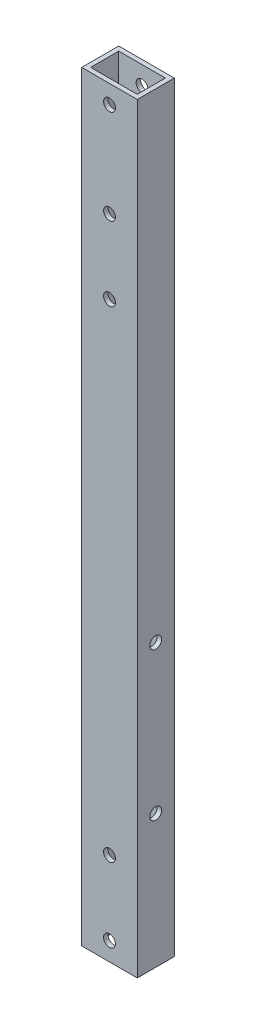
from build123d import *

# Parameters (mm, degrees)
SKETCH_1_W          = 15
SKETCH_1_H          = 10
SKETCH_1_W_2        = 12.6
SKETCH_1_H_2        = 7.6
EXTRUDE_1_DEPTH     = 110
SKETCH_2_R          = 1.6
CUT_EXTRUDE_1_DEPTH = 100
SKETCH_3_R          = 1.6
CUT_EXTRUDE_2_DEPTH = 15
SKETCH_4_R          = 1.6
CUT_EXTRUDE_3_DEPTH = 10
SKETCH_5_W          = 15
SKETCH_5_H          = 10
CUT_EXTRUDE_4_DEPTH = 14.5
SKETCH_6_R          = 1.6
CUT_EXTRUDE_5_DEPTH = 15


with BuildPart() as part:
    # ｽｹｯﾁ1 → ﾎﾞｽ - 押し出し1 (new, symmetric)
    with BuildSketch(Plane(origin=(0, 0, 0), x_dir=(1, 0, 0), z_dir=(0, 1, 0))):
        Rectangle(SKETCH_1_W, SKETCH_1_H)
        Rectangle(SKETCH_1_W_2, SKETCH_1_H_2, mode=Mode.SUBTRACT)
    extrude(amount=EXTRUDE_1_DEPTH, both=True)

    # ｽｹｯﾁ2 → ｶｯﾄ - 押し出し1 (cut)
    with BuildSketch(Plane(origin=(0, 0, -5), x_dir=(-1, 0, 0), z_dir=(0, 0, -1))):
        with Locations((0, -85)):
            Circle(SKETCH_2_R)
        with Locations((0, -105)):
            Circle(SKETCH_2_R)
    extrude(amount=-CUT_EXTRUDE_1_DEPTH, mode=Mode.SUBTRACT)

    # ｽｹｯﾁ3 → ｶｯﾄ - 押し出し2 (cut)
    with BuildSketch(Plane(origin=(7.5, 0, 0), x_dir=(0, 0, -1), z_dir=(1, 0, 0))):
        with Locations((0, -34)):
            Circle(SKETCH_3_R)
        with Locations((0, -74)):
            Circle(SKETCH_3_R)
    extrude(amount=-CUT_EXTRUDE_2_DEPTH, mode=Mode.SUBTRACT)

    # ｽｹｯﾁ4 → ｶｯﾄ - 押し出し3 (cut)
    with BuildSketch(Plane(origin=(0, 0, -5), x_dir=(-1, 0, 0), z_dir=(0, 0, -1))):
        with Locations((0, 65)):
            Circle(SKETCH_4_R)
        with Locations((0, 45)):
            Circle(SKETCH_4_R)
    extrude(amount=-CUT_EXTRUDE_3_DEPTH, mode=Mode.SUBTRACT)

    # ｽｹｯﾁ5 → ｶｯﾄ - 押し出し4 (cut)
    with BuildSketch(Plane(origin=(0, 110, 0), x_dir=(1, 0, 0), z_dir=(0, 1, 0))):
        Rectangle(SKETCH_5_W, SKETCH_5_H)
    extrude(amount=-CUT_EXTRUDE_4_DEPTH, mode=Mode.SUBTRACT)

    # ｽｹｯﾁ6 → ｶｯﾄ - 押し出し5 (cut)
    with BuildSketch(Plane(origin=(0, 0, -5), x_dir=(-1, 0, 0), z_dir=(0, 0, -1))):
        with Locations((0, 90.5)):
            Circle(SKETCH_6_R)
    extrude(amount=-CUT_EXTRUDE_5_DEPTH, mode=Mode.SUBTRACT)


solid = part.part
